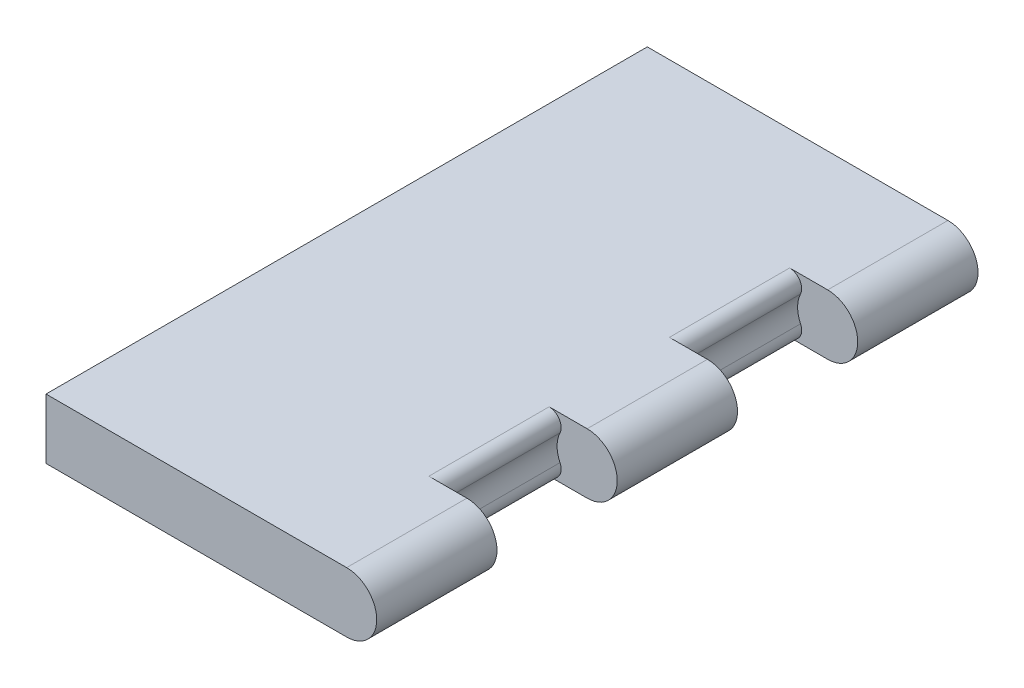
from build123d import *

# Parameters (mm, degrees)
SKETCH1_R      = 4.999999999999997
EXTRUDE1_DEPTH = 100
EXTRUDE3_START = 20
SKETCH1_5_R    = 4.999999999999997
EXTRUDE3_DEPTH = 20
EXTRUDE5_START = 60
SKETCH1_7_R    = 4.999999999999997
EXTRUDE5_DEPTH = 20
FILLET1_R      = 2


with BuildPart() as part:
    # Sketch1 → Extrude1 (new body)
    with BuildSketch(Plane.XY):
        with Locations((50, 5.000000000000032)):
            Circle(SKETCH1_R)
        Polygon((0, 0), (50, 2.082e-14), (50, 10.00000000000003), (-1.84e-15, 10.00000000000004), align=None)
    extrude(amount=EXTRUDE1_DEPTH)

    # Sketch1<5> → Extrude3 (cut)
    with BuildSketch(Plane.XY.offset(EXTRUDE3_START)):
        with Locations((50, 5.000000000000032)):
            Circle(SKETCH1_5_R)
    extrude(amount=EXTRUDE3_DEPTH, mode=Mode.SUBTRACT)

    # Sketch1<7> → Extrude5 (cut)
    with BuildSketch(Plane.XY.offset(EXTRUDE5_START)):
        with Locations((50, 5.000000000000032)):
            Circle(SKETCH1_7_R)
    extrude(amount=EXTRUDE5_DEPTH, mode=Mode.SUBTRACT)

    # Fillet1
    fillet1_edges = [part.edges().sort_by_distance(p)[0] for p in [
        (50, 10.00000000000003, 30),
        (50, 2.082e-14, 30),
        (50, 2.082e-14, 70),
        (50, 10.00000000000003, 70),
    ]]
    fillet(fillet1_edges, radius=FILLET1_R)


solid = part.part
